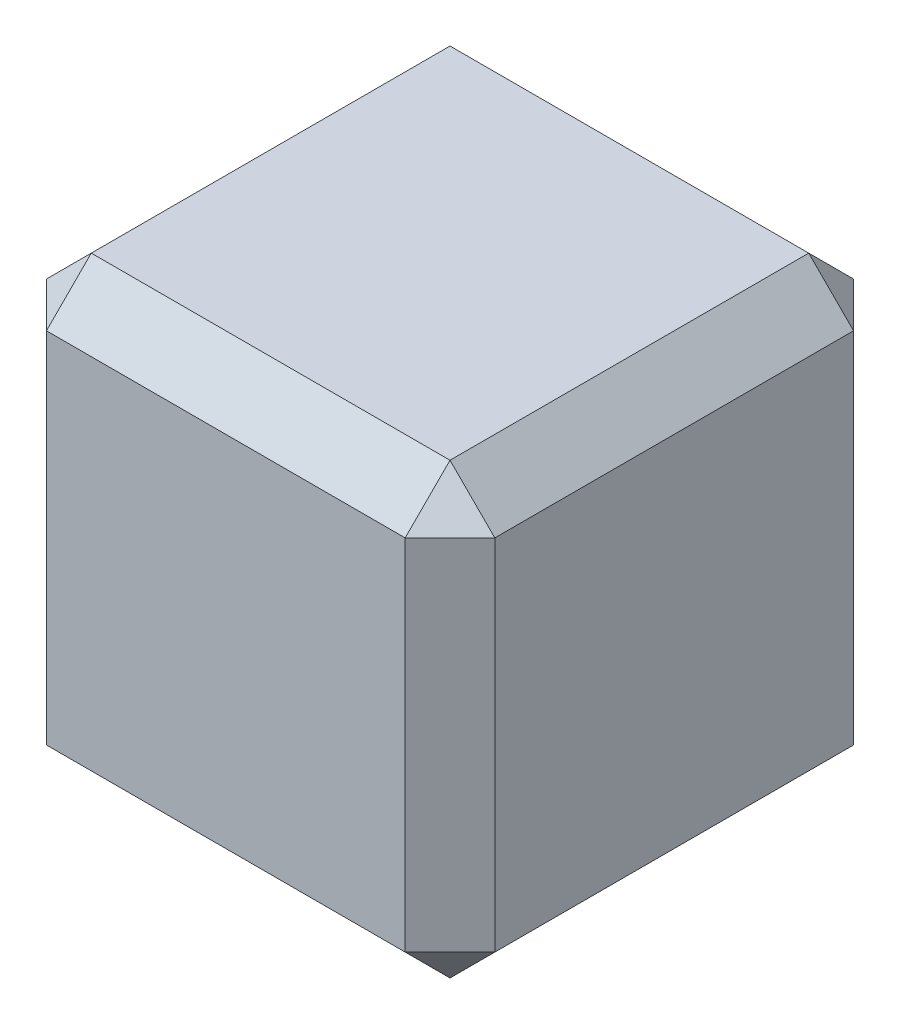
from build123d import *

# Parameters (mm, degrees)
ESBO_O1_W                = 10
ESBO_O1_H                = 10
RESSALTO_EXTRUS_O1_DEPTH = 5
CASCA2_T                 = 1
CHANFRO1_SIZE            = 1


with BuildPart() as part:
    # Esboço1 → Ressalto-extrusão1 (new, symmetric)
    with BuildSketch(Plane(origin=(0, 0, 0), x_dir=(1, 0, 0), z_dir=(0, 1, 0))):
        Rectangle(ESBO_O1_W, ESBO_O1_H)
    extrude(amount=RESSALTO_EXTRUS_O1_DEPTH, both=True)

    # Casca2 (no face opened: a closed hollow body)
    add(offset(amount=-CASCA2_T, mode=Mode.PRIVATE), mode=Mode.SUBTRACT)

    # Chanfro1
    chanfro1_edges = [part.edges().sort_by_distance(p)[0] for p in [
        (-5, 5, 0),
        (0, 5, 5),
        (5, 5, 0),
        (0, -5, 5),
        (-5, -5, 0),
        (0, -5, -5),
        (5, -5, 0),
        (5, 0, 5),
        (-5, 0, 5),
        (-5, 0, -5),
        (5, 0, -5),
        (0, 5, -5),
    ]]
    chamfer(chanfro1_edges, length=CHANFRO1_SIZE)


solid = part.part
